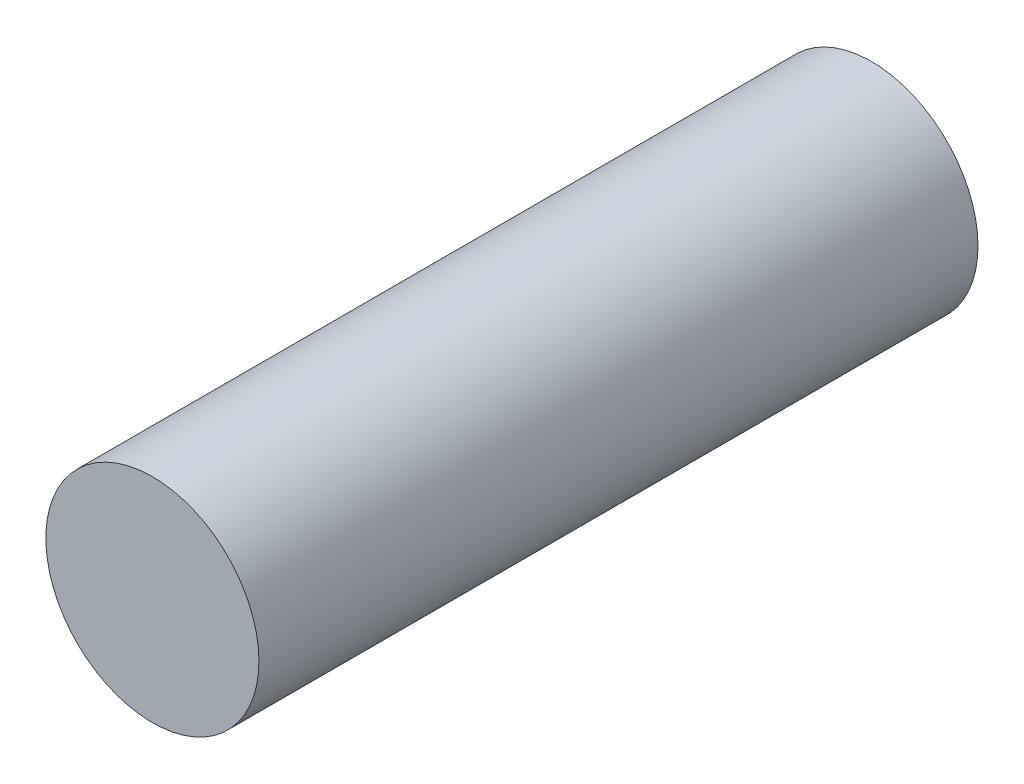
from build123d import *

# Parameters (mm, degrees)
SKETCH1_R                        = 4.445
L12_SHAFT_DEPTH                  = 30
TAP_DRILL_FOR_M8X1_25_TAP1_D     = 6.8
TAP_DRILL_FOR_M8X1_25_TAP1_DEPTH = 9.525
TAP_DRILL_FOR_M8X1_25_TAP1_TIP   = 2.042926105


with BuildPart() as part:
    # Sketch1 → L12_Shaft (new body)
    with BuildSketch(Plane.XY):
        Circle(SKETCH1_R)
    extrude(amount=L12_SHAFT_DEPTH)

    # Tap Drill for M8x1.25 Tap1
    with Locations(Plane(origin=(0, 0, 0), x_dir=(-1, 0, 0), z_dir=(0, 0, -1))):
        with Locations((0, 0)):
            Hole(TAP_DRILL_FOR_M8X1_25_TAP1_D / 2, depth=TAP_DRILL_FOR_M8X1_25_TAP1_DEPTH)
            with Locations((0, 0, -(TAP_DRILL_FOR_M8X1_25_TAP1_DEPTH + TAP_DRILL_FOR_M8X1_25_TAP1_TIP / 2))):  # 118° drill point
                Cone(0, TAP_DRILL_FOR_M8X1_25_TAP1_D / 2, TAP_DRILL_FOR_M8X1_25_TAP1_TIP, mode=Mode.SUBTRACT)


solid = part.part
